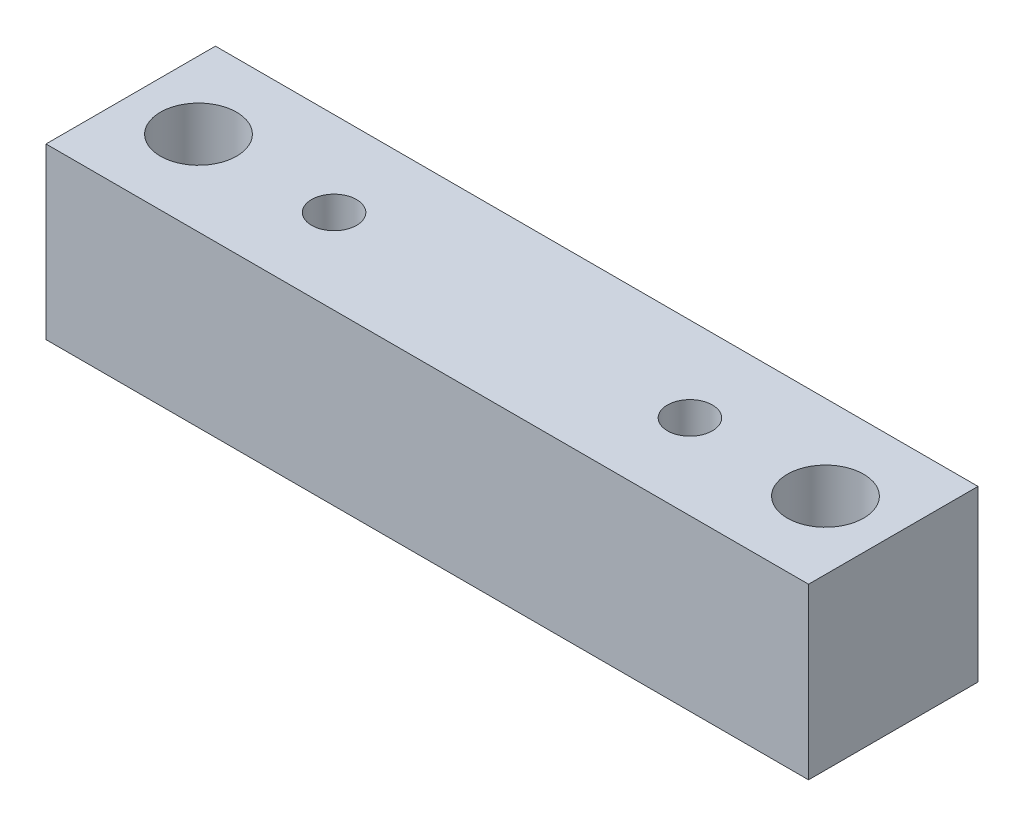
from build123d import *

# Parameters (mm, degrees)
SKETCH1_W           = 90
SKETCH1_H           = 20
SKETCH1_R           = 2.65
SKETCH1_R_2         = 2.75
BOSS_EXTRUDE1_DEPTH = 20
CUT_EXTRUDE1_DEPTH  = 14
SKETCH3_R           = 4.5
CUT_EXTRUDE2_DEPTH  = 13


with BuildPart() as part:
    # Sketch1 → Boss-Extrude1 (new body)
    with BuildSketch(Plane(origin=(0, 0, 0), x_dir=(1, 0, 0), z_dir=(0, 1, 0))):
        Rectangle(SKETCH1_W, SKETCH1_H)
        with Locations(Location((-21, 0, 0), (0, 0, 270))):
            Circle(SKETCH1_R, mode=Mode.SUBTRACT)
        with Locations(Location((21, 0, 0), (0, 0, 270))):
            Circle(SKETCH1_R, mode=Mode.SUBTRACT)
        with Locations(Location((-37, 0, 0), (0, 0, 270))):
            Circle(SKETCH1_R_2, mode=Mode.SUBTRACT)
        with Locations(Location((37, 0, 0), (0, 0, 270))):
            Circle(SKETCH1_R_2, mode=Mode.SUBTRACT)
    extrude(amount=BOSS_EXTRUDE1_DEPTH)

    # Sketch2 → Cut-Extrude1 (cut)
    with BuildSketch(Plane.XZ):
        Polygon((-16.265727793, 0), (-18.632863896, 4.1), (-23.367136104, 4.1), (-25.734272207, 0), (-23.367136104, -4.1), (-18.632863896, -4.1), align=None)
        Polygon((25.734272207, 0), (23.367136104, 4.1), (18.632863896, 4.1), (16.265727793, 0), (18.632863896, -4.1), (23.367136104, -4.1), align=None)
    extrude(amount=-CUT_EXTRUDE1_DEPTH, mode=Mode.SUBTRACT)

    # Sketch3 → Cut-Extrude2 (cut)
    with BuildSketch(Plane(origin=(0, 20, 0), x_dir=(1, 0, 0), z_dir=(0, 1, 0))):
        with Locations(Location((-37, 0, 0), (0, 0, 270))):
            Circle(SKETCH3_R)
        with Locations(Location((37, 0, 0), (0, 0, 270))):
            Circle(SKETCH3_R)
    extrude(amount=-CUT_EXTRUDE2_DEPTH, mode=Mode.SUBTRACT)


solid = part.part
